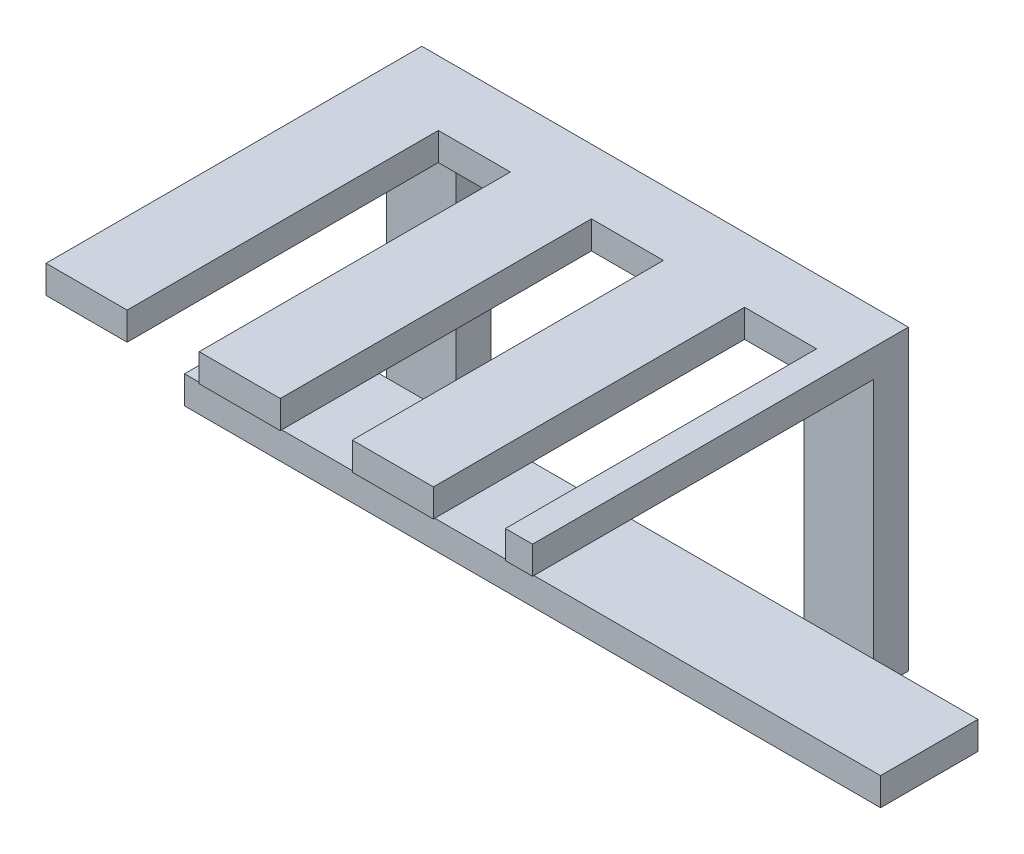
from build123d import *

# Parameters (mm, degrees)
SKETCH2_W           = 100
SKETCH2_H           = 14
BOSS_EXTRUDE1_DEPTH = 4
SKETCH3_W           = 10
SKETCH3_H           = 4
BOSS_EXTRUDE2_DEPTH = 5
SKETCH4_W           = 10
SKETCH4_H           = 5
BOSS_EXTRUDE3_DEPTH = 34.8
SKETCH5_W           = 69.90455619
SKETCH5_H           = 4
BOSS_EXTRUDE4_DEPTH = 54
SKETCH6_W           = 10.347488473
SKETCH6_H           = 44.707321825
CUT_EXTRUDE1_DEPTH  = 14


with BuildPart() as part:
    # Sketch2 → Boss-Extrude1 (new body)
    with BuildSketch(Plane(origin=(0, 0, 0), x_dir=(1, 0, 0), z_dir=(0, 1, 0))):
        Rectangle(SKETCH2_W, SKETCH2_H)
    extrude(amount=BOSS_EXTRUDE1_DEPTH)

    # Sketch3 → Boss-Extrude2 (add)
    with BuildSketch(Plane(origin=(0, 0, -7), x_dir=(-1, 0, 0), z_dir=(0, 0, -1))):
        with Locations((-30, 2)):
            Rectangle(SKETCH3_W, SKETCH3_H)
        with Locations((30, 2)):
            Rectangle(SKETCH3_W, SKETCH3_H)
    extrude(amount=BOSS_EXTRUDE2_DEPTH)

    # Sketch4 → Boss-Extrude3 (add)
    with BuildSketch(Plane(origin=(0, 4, 0), x_dir=(1, 0, 0), z_dir=(0, 1, 0))):
        with Locations((-30, 9.5)):
            Rectangle(SKETCH4_W, SKETCH4_H)
        with Locations((30, 9.5)):
            Rectangle(SKETCH4_W, SKETCH4_H)
    extrude(amount=BOSS_EXTRUDE3_DEPTH)

    # Sketch5 → Boss-Extrude4 (add)
    with BuildSketch(Plane(origin=(0, 0, -12), x_dir=(-1, 0, 0), z_dir=(0, 0, -1))):
        with Locations((-0.047721905, 40.8)):
            Rectangle(SKETCH5_W, SKETCH5_H)
    extrude(amount=-BOSS_EXTRUDE4_DEPTH)

    # Sketch6 → Cut-Extrude1 (cut)
    with BuildSketch(Plane(origin=(0, 42.8, 0), x_dir=(1, 0, 0), z_dir=(0, 1, 0))):
        with Locations((-18.071670011, -19.646339087)):
            Rectangle(SKETCH6_W, SKETCH6_H)
        with Locations((3.92832999, -19.646339087)):
            Rectangle(SKETCH6_W, SKETCH6_H)
        with Locations((25.928329989, -19.646339087)):
            Rectangle(SKETCH6_W, SKETCH6_H)
    extrude(amount=-CUT_EXTRUDE1_DEPTH, mode=Mode.SUBTRACT)


solid = part.part
